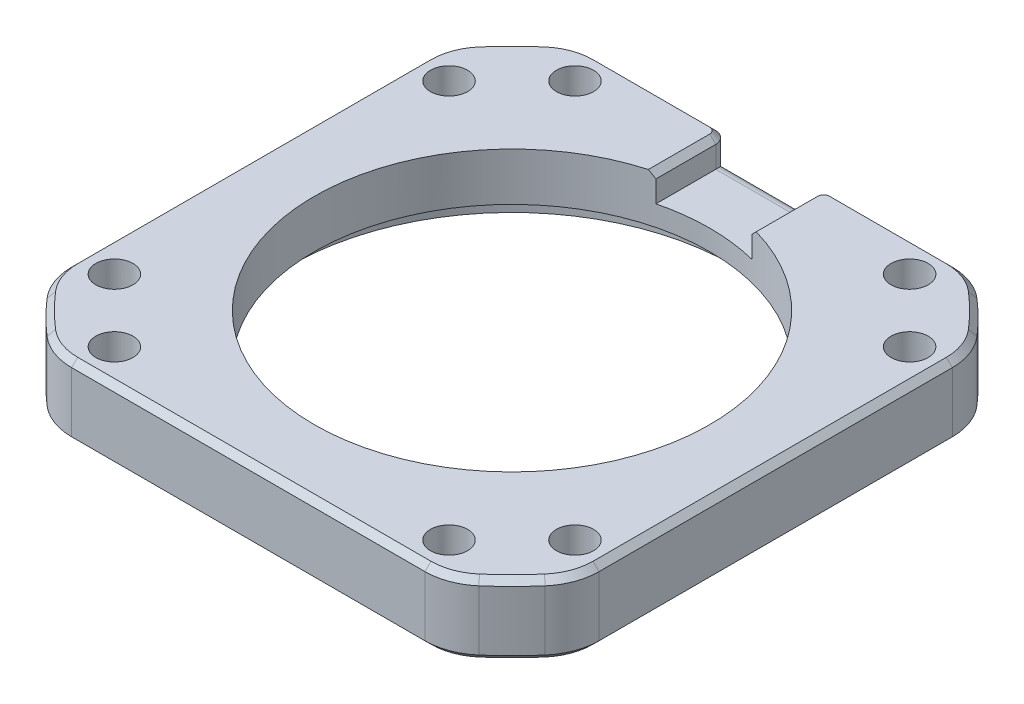
from build123d import *

# Parameters (mm, degrees)
EXTRUDE_1_DEPTH      = 6
SKETCH_2_R           = 10.5
CUT_EXTRUDE_1_DEPTH  = 10
SKETCH_3_R           = 1.55
CUT_EXTRUDE_2_DEPTH  = 10
SKETCH_7_W           = 16
SKETCH_7_H           = 44.832254491
CUT_EXTRUDE_4_DEPTH  = 10
FILLET_1_R           = 3
FILLET_2_R           = 5
EXTRUDE_START        = -6
EXTRUDE_2_DEPTH      = 6
SKETCH_9_R           = 9.75
CUT_EXTRUDE_5_DEPTH  = 32.685959036
SKETCH_10_R          = 13
CUT_EXTRUDE_6_DEPTH  = 2
SKETCH_11_W          = 8
SKETCH_11_H          = 16
CUT_EXTRUDE_7_DEPTH  = 2.3
FILLET_3_R           = 1
EXTRUDE_3_DEPTH      = 6
SKETCH_13_W          = 8
SKETCH_13_H          = 3
CUT_EXTRUDE_8_DEPTH  = 2.3
FILLET_4_R           = 1
CHAMFER_1_SIZE       = 0.5
EXTRUDE_START_2      = 3
SKETCH_14_R          = 15
SKETCH_14_R_2        = 13
EXTRUDE_4_DEPTH      = 3
CHAMFER_2_SIZE       = 0.5
SKETCH_15_R          = 17.000673468
CUT_EXTRUDE_9_DEPTH  = 23
SKETCH_17_R          = 18.5
CUT_EXTRUDE_11_DEPTH = 2
SKETCH_18_R          = 16.5
CUT_EXTRUDE_12_DEPTH = 14


with BuildPart() as part:
    # 草图1 → 凸台-拉伸1 (new body)
    with BuildSketch(Plane(origin=(0, 0, 0), x_dir=(1, 0, 0), z_dir=(0, 1, 0))):
        with BuildLine():
            Line((-16.5, 22), (16.5, 22))
            ThreePointArc((16.5, 22), (19.445436483, 19.445436483), (22, 16.5))
            Line((22, 16.5), (22, -16.5))
            ThreePointArc((22, -16.5), (19.445436483, -19.445436483), (16.5, -22))
            Line((16.5, -22), (-16.5, -22))
            ThreePointArc((-16.5, -22), (-19.445436483, -19.445436483), (-22, -16.5))
            Line((-22, -16.5), (-22, 16.5))
            ThreePointArc((-22, 16.5), (-19.445436483, 19.445436483), (-16.5, 22))
        make_face()
    extrude(amount=EXTRUDE_1_DEPTH)

    # 草图2 → 切除-拉伸1 (cut)
    with BuildSketch(Plane(origin=(0, 6, 0), x_dir=(1, 0, 0), z_dir=(0, 1, 0))):
        with Locations(Location((0, 0, 0), (0, 0, 270))):
            Circle(SKETCH_2_R)
    extrude(amount=-CUT_EXTRUDE_1_DEPTH, mode=Mode.SUBTRACT)

    # 草图3 → 切除-拉伸2 (cut)
    with BuildSketch(Plane(origin=(0, 6, 0), x_dir=(1, 0, 0), z_dir=(0, 1, 0))):
        with Locations(Location((-19.214153616, 13.959899742, 0), (0, 0, 270))):
            Circle(SKETCH_3_R)
        with Locations(Location((-13.959899742, 19.214153616, 0), (0, 0, 270))):
            Circle(SKETCH_3_R)
        with Locations(Location((19.214153616, 13.959899742, 0), (0, 0, 270))):
            Circle(SKETCH_3_R)
        with Locations(Location((13.959899742, 19.214153616, 0), (0, 0, 270))):
            Circle(SKETCH_3_R)
        with Locations(Location((19.214153616, -13.959899742, 0), (0, 0, 270))):
            Circle(SKETCH_3_R)
        with Locations(Location((13.959899742, -19.214153616, 0), (0, 0, 270))):
            Circle(SKETCH_3_R)
        with Locations(Location((-19.214153616, -13.959899742, 0), (0, 0, 270))):
            Circle(SKETCH_3_R)
        with Locations(Location((-13.959899742, -19.214153616, 0), (0, 0, 270))):
            Circle(SKETCH_3_R)
    extrude(amount=-CUT_EXTRUDE_2_DEPTH, mode=Mode.SUBTRACT)

    # 草图7 → 切除-拉伸4 (cut)
    with BuildSketch(Plane(origin=(0, 6, 0), x_dir=(1, 0, 0), z_dir=(0, 1, 0))):
        with Locations((0, 26.514900262)):
            Rectangle(SKETCH_7_W, SKETCH_7_H)
    extrude(amount=-CUT_EXTRUDE_4_DEPTH, mode=Mode.SUBTRACT)

    # 圆角1
    fillet_1_edges = [part.edges().sort_by_distance(p)[0] for p in [
        (-8, 3, -22),
        (8, 3, -22),
    ]]
    fillet(fillet_1_edges, radius=FILLET_1_R)

    # 圆角2
    fillet_2_edges = [part.edges().sort_by_distance(p)[0] for p in [
        (-16.5, 3, -22),
        (16.5, 3, -22),
        (22, 3, -16.5),
        (22, 3, 16.5),
        (16.5, 3, 22),
        (-16.5, 3, 22),
        (-22, 3, 16.5),
        (-22, 3, -16.5),
    ]]
    fillet(fillet_2_edges, radius=FILLET_2_R)

    # 草图8 → 凸台-拉伸2 (add)
    with BuildSketch(Plane.XZ.offset(EXTRUDE_START)):
        with BuildLine():
            Line((8, -6.800735254), (8, -19))
            Line((8, -19), (-8, -19))
            Line((-8, -19), (-8, -6.800735254))
            ThreePointArc((-8, -6.800735254), (0, 10.5), (8, -6.800735254))
        make_face()
    extrude(amount=EXTRUDE_2_DEPTH)

    # 草图9 → 切除-拉伸5 (cut, through all)
    with BuildSketch(Plane.XZ):
        with Locations(Location((0, 0, 0), (0, 0, 270))):
            Circle(SKETCH_9_R)
    extrude(amount=-CUT_EXTRUDE_5_DEPTH, mode=Mode.SUBTRACT)

    # 草图10 → 切除-拉伸6 (cut)
    with BuildSketch(Plane.XZ):
        with Locations(Location((0, 0, 0), (0, 0, 270))):
            Circle(SKETCH_10_R)
    extrude(amount=-CUT_EXTRUDE_6_DEPTH, mode=Mode.SUBTRACT)

    # 草图11 → 切除-拉伸7 (cut)
    with BuildSketch(Plane(origin=(0, 6, 0), x_dir=(1, 0, 0), z_dir=(0, 1, 0))):
        with Locations((0, 16.891709622)):
            Rectangle(SKETCH_11_W, SKETCH_11_H)
    extrude(amount=-CUT_EXTRUDE_7_DEPTH, mode=Mode.SUBTRACT)

    # 圆角3
    fillet_3_edges = [part.edges().sort_by_distance(p)[0] for p in [
        (4, 4.85, -8.891709622),
        (-4, 4.85, -8.891709622),
        (2.045523305, 3.7, -9.533012871),
    ]]
    fillet(fillet_3_edges, radius=FILLET_3_R)

    # 草图12 → 凸台-拉伸3 (add)
    with BuildSketch(Plane.XZ):
        with BuildLine():
            Line((-11, -22), (11, -22))
            ThreePointArc((11, -22), (8.878679656, -21.121320344), (8, -19))
            Line((8, -19), (-8, -19))
            ThreePointArc((-8, -19), (-8.878679656, -21.121320344), (-11, -22))
        make_face()
    extrude(amount=-EXTRUDE_3_DEPTH)

    # 草图13 → 切除-拉伸8 (cut)
    with BuildSketch(Plane(origin=(0, 6, 0), x_dir=(1, 0, 0), z_dir=(0, 1, 0))):
        with Locations((0, 20.5)):
            Rectangle(SKETCH_13_W, SKETCH_13_H)
    extrude(amount=-CUT_EXTRUDE_8_DEPTH, mode=Mode.SUBTRACT)

    # 圆角4
    fillet_4_edges = [part.edges().sort_by_distance(p)[0] for p in [
        (0, 3.7, -22),
        (-4, 4.85, -22),
        (4, 4.85, -22),
    ]]
    fillet(fillet_4_edges, radius=FILLET_4_R)

    # 倒角1
    chamfer_1_edges = [part.edges().sort_by_distance(p)[0] for p in [
        (9.869701486, 6, -22),
        (0, 0, -22),
        (19.445436483, 0, 19.445436483),
        (19.445436483, 6, 19.445436483),
        (19.445436483, 0, -19.445436483),
        (22, 0, 0),
        (0, 0, 22),
        (-19.445436483, 0, 19.445436483),
        (-22, 0, 0),
        (-19.445436483, 0, -19.445436483),
        (-16.48741772, 0, -21.684489774),
        (-21.684489774, 0, -16.48741772),
        (-21.684489774, 0, 16.48741772),
        (-16.48741772, 0, 21.684489774),
        (16.48741772, 0, -21.684489774),
        (21.684489774, 0, -16.48741772),
        (21.684489774, 0, 16.48741772),
        (16.48741772, 0, 21.684489774),
        (0, 6, 22),
        (-19.445436483, 6, -19.445436483),
        (-22, 6, 0),
        (-19.445436483, 6, 19.445436483),
        (22, 6, 0),
        (19.445436483, 6, -19.445436483),
        (-16.48741772, 6, -21.684489774),
        (-21.684489774, 6, -16.48741772),
        (-21.684489774, 6, 16.48741772),
        (-16.48741772, 6, 21.684489774),
        (16.48741772, 6, -21.684489774),
        (21.684489774, 6, -16.48741772),
        (21.684489774, 6, 16.48741772),
        (16.48741772, 6, 21.684489774),
        (0, 6, 9.75),
        (4, 6, -15.258216578),
        (4.144103897, 6, -8.999285342),
        (-4.144103897, 6, -8.999285342),
        (-4, 6, -15.258216578),
        (-9.869701486, 6, -22),
        (4.292893219, 6, -21.707106781),
        (-4.292893219, 6, -21.707106781),
    ]]
    chamfer(chamfer_1_edges, length=CHAMFER_1_SIZE)

    # 草图14 → 凸台-拉伸4 (add)
    with BuildSketch(Plane.XZ.offset(EXTRUDE_START_2)):
        with Locations(Location((0, 0, 0), (0, 0, 90))):
            Circle(SKETCH_14_R)
        with Locations(Location((0, 0, 0), (0, 0, 270))):
            Circle(SKETCH_14_R_2, mode=Mode.SUBTRACT)
    extrude(amount=-EXTRUDE_4_DEPTH)

    # 倒角2
    chamfer_2_edges = [part.edges().sort_by_distance(p)[0] for p in [
        (0, -3, -15),
        (0, -3, 13),
    ]]
    chamfer(chamfer_2_edges, length=CHAMFER_2_SIZE)

    # 草图15 → 切除-拉伸9 (cut)
    with BuildSketch(Plane.XZ):
        Circle(SKETCH_15_R)
    extrude(amount=CUT_EXTRUDE_9_DEPTH, mode=Mode.SUBTRACT)

    # 草图17 → 切除-拉伸11 (cut)
    with BuildSketch(Plane.XZ):
        with Locations(Location((0, 0, 0), (0, 0, 270))):
            Circle(SKETCH_17_R)
    extrude(amount=-CUT_EXTRUDE_11_DEPTH, mode=Mode.SUBTRACT)

    # 草图18 → 切除-拉伸12 (cut)
    with BuildSketch(Plane.XZ.offset(-2)):
        with Locations(Location((0, 0, 0), (0, 0, 270))):
            Circle(SKETCH_18_R)
    extrude(amount=-CUT_EXTRUDE_12_DEPTH, mode=Mode.SUBTRACT)


solid = part.part
